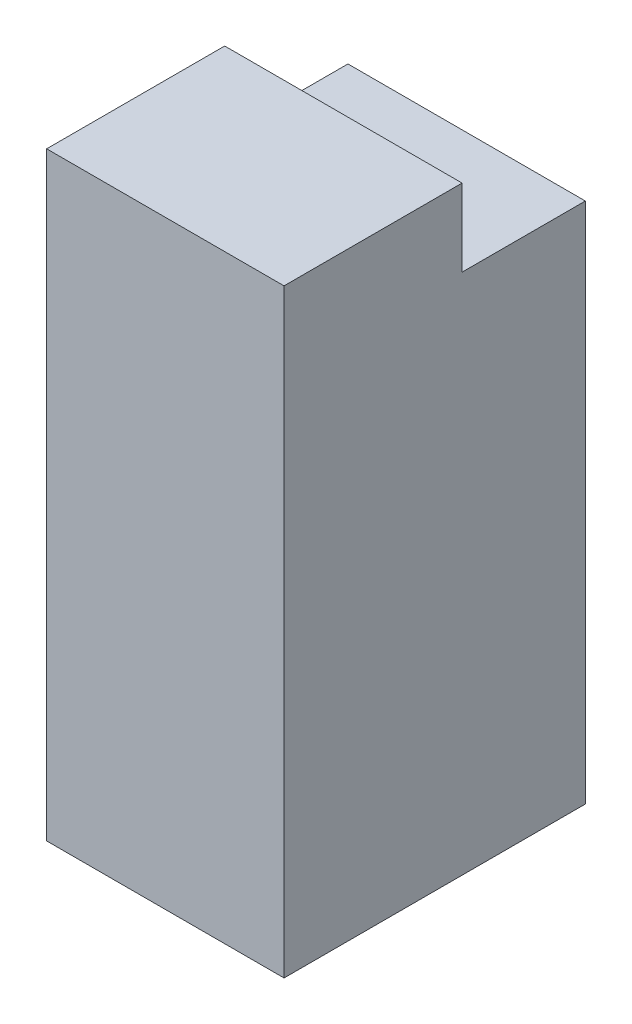
from build123d import *

# Parameters (mm, degrees)
SKETCH1_W           = 400
SKETCH1_H           = 300
BOSS_EXTRUDE1_DEPTH = 1010


with BuildPart() as part:
    # Sketch1 → Boss-Extrude1 (new body)
    with BuildSketch(Plane.XZ.offset(4290)):
        with Locations((-200, 150)):
            Rectangle(SKETCH1_W, SKETCH1_H)
    extrude(amount=BOSS_EXTRUDE1_DEPTH)

    # Sketch2 → Loft1 section 0
    with BuildSketch(Plane(origin=(0, 0, -207.664317166), x_dir=(-1, 0, 0), z_dir=(0, 0, -1))):
        with BuildLine():
            Line((400, -5300), (0, -5300))
            Line((0, -5300), (0, -4420))
            Line((0, -4420), (400, -4420))
            Line((400, -4420), (400, -5300))
        make_face()
    # Sketch4 → Loft1 section 1
    with BuildSketch(Plane(origin=(0, 0, 0), x_dir=(-1, 0, 0), z_dir=(0, 0, -1))):
        with BuildLine():
            Line((0, -5300), (400, -5300))
            Line((400, -5300), (400, -4420))
            Line((400, -4420), (0, -4420))
            Line((0, -4420), (0, -5300))
        make_face()
    loft()


solid = part.part
